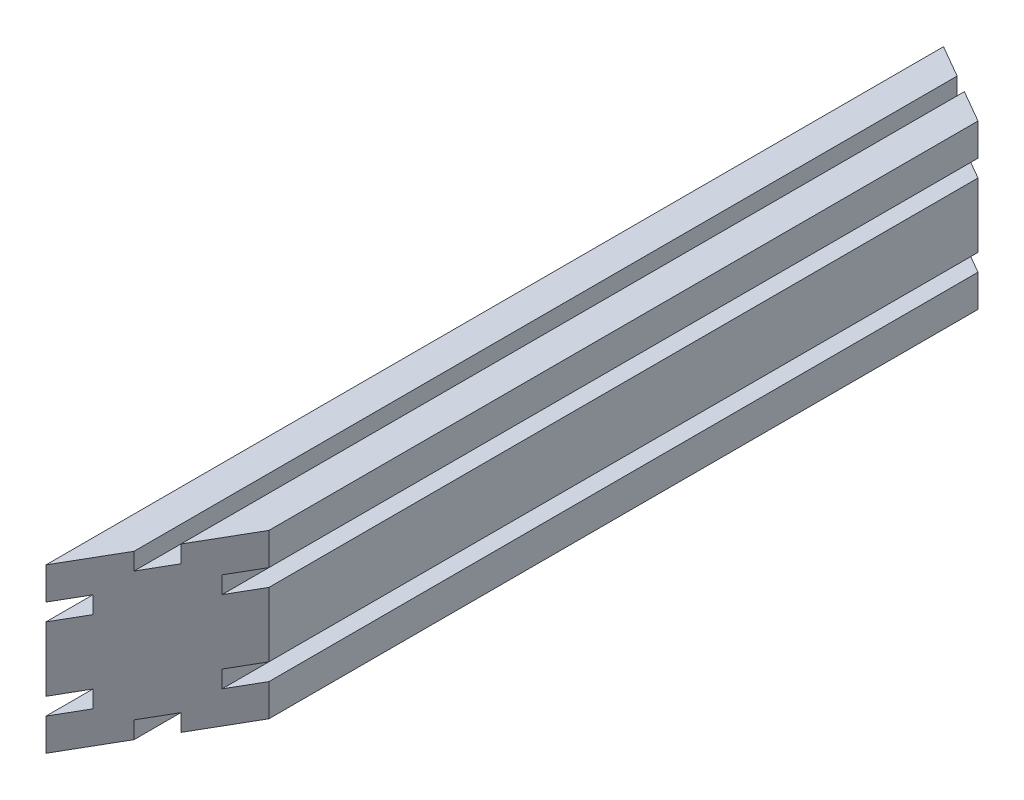
from build123d import *

# Parameters (mm, degrees)
PROFILE_DEPTH     = 419.1
MITER1_DEPTH      = 422.259210582
MITER1_DEPTH_BACK = 422.259210582
MITER2_DEPTH      = 422.259210582
MITER2_DEPTH_BACK = 422.259210582


with BuildPart() as part:
    # Sketch1 → Profile (new body)
    with BuildSketch(Plane.XY):
        Polygon((-19.05, -38.1), (-4, -38.1), (-4, -30.1), (4, -30.1), (4, -38.1), (19.05, -38.1), (19.05, -23.05), (11.05, -23.05), (11.05, -15.05), (19.05, -15.05), (19.05, 15.05), (11.05, 15.05), (11.05, 23.05), (19.05, 23.05), (19.05, 38.1), (4, 38.1), (4, 30.1), (-4, 30.1), (-4, 38.1), (-19.05, 38.1), (-19.05, 23.05), (-11.05, 23.05), (-11.05, 15.05), (-19.05, 15.05), (-19.05, -15.05), (-11.05, -15.05), (-11.05, -23.05), (-19.05, -23.05), align=None)
    extrude(amount=PROFILE_DEPTH)

    # Sketch2 → Miter1 (cut, two sides: drawn at the far end of the back side and taken through both)
    with BuildSketch(Plane(origin=(0, 0, 0), x_dir=(1, 0, 0), z_dir=(0, 1, 0)).offset(-MITER1_DEPTH_BACK)):
        Polygon((-19.05, -419.1), (25, -342.8), (25, -430), align=None)
    extrude(amount=MITER1_DEPTH + MITER1_DEPTH_BACK, mode=Mode.SUBTRACT)

    # Sketch3 → Miter2 (cut, two sides: drawn at the far end of the back side and taken through both)
    with BuildSketch(Plane(origin=(0, 0, 0), x_dir=(1, 0, 0), z_dir=(0, 1, 0)).offset(-MITER2_DEPTH_BACK)):
        Polygon((-19.05, 0), (25, 10), (25, -25.43), align=None)
    extrude(amount=MITER2_DEPTH + MITER2_DEPTH_BACK, mode=Mode.SUBTRACT)


solid = part.part
